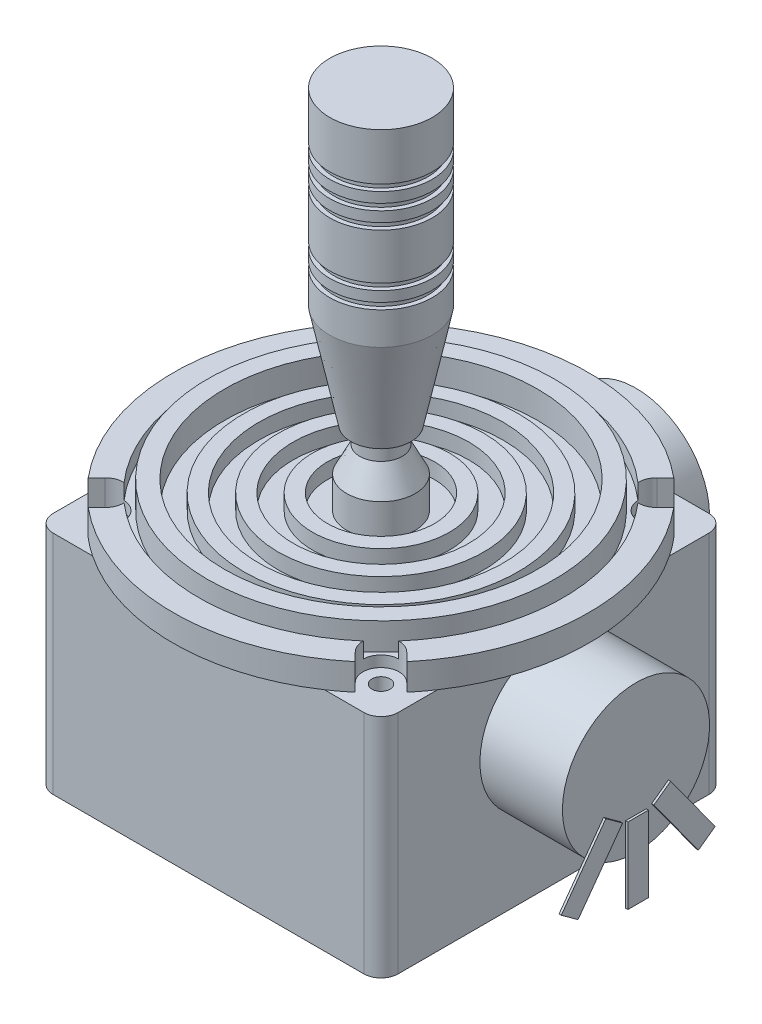
from build123d import *

# Parameters (mm, degrees)
BOSS_EXTRUDE1_DEPTH         = 13.21
SKETCH2_R                   = 8.585
BOSS_EXTRUDE2_DEPTH         = 9.63
SKETCH3_W                   = 2.42
SKETCH3_H                   = 8.85
BOSS_EXTRUDE3_DEPTH         = 0.26
CIRPATTERN2_COUNT           = 10
CIRPATTERN1_COUNT           = 2
CIRPATTERN1_ANGLE           = 90
CIRPATTERN1_COPY_1_SKETCH_W = 2.42
CIRPATTERN1_COPY_1_SKETCH_H = 8.85
CIRPATTERN1_COPY_1_DEPTH    = 0.26
CIRPATTERN1_COPY_2_SKETCH_W = 2.42
CIRPATTERN1_COPY_2_SKETCH_H = 8.85
CIRPATTERN1_COPY_2_DEPTH    = 0.26
CUT_EXTRUDE1_REACH          = 60.953
SKETCH7_R                   = 1.05
CUT_EXTRUDE2_DEPTH          = 4


with BuildPart() as part:
    # Sketch1 → Boss-Extrude1 (new, symmetric)
    with BuildSketch(Plane(origin=(0, 0, 0), x_dir=(1, 0, 0), z_dir=(0, 1, 0))):
        with BuildLine():
            Line((18.125, 20.125), (-18.125, 20.125))
            ThreePointArc((-18.125, 20.125), (-19.539213562, 19.539213562), (-20.125, 18.125))
            Line((-20.125, 18.125), (-20.125, -18.125))
            ThreePointArc((-20.125, -18.125), (-19.539213562, -19.539213562), (-18.125, -20.125))
            Line((-18.125, -20.125), (18.125, -20.125))
            ThreePointArc((18.125, -20.125), (19.539213562, -19.539213562), (20.125, -18.125))
            Line((20.125, -18.125), (20.125, 18.125))
            ThreePointArc((20.125, 18.125), (19.539213562, 19.539213562), (18.125, 20.125))
        make_face()
    extrude(amount=BOSS_EXTRUDE1_DEPTH, both=True)

    # Sketch2 → Boss-Extrude2 (add)
    with BuildSketch(Plane(origin=(20.125, 0, 0), x_dir=(0, 0, -1), z_dir=(1, 0, 0))):
        with Locations(Location((0, 3.395, 0), (0, 0, 180))):
            Circle(SKETCH2_R)
    boss_extrude2 = extrude(amount=BOSS_EXTRUDE2_DEPTH)

    # Sketch3 → Boss-Extrude3 (add)
    with BuildSketch(Plane(origin=(29.755, 0, 0), x_dir=(0, 0, -1), z_dir=(1, 0, 0))):
        with Locations((0, -5.795)):
            Rectangle(SKETCH3_W, SKETCH3_H)
    boss_extrude3 = extrude(amount=BOSS_EXTRUDE3_DEPTH)

    # CirPattern2: Boss-Extrude3 ×10 about axis, 7 skipped
    cirpattern2_axis = Axis((0, 3.395, 0), (1, 0, 0))
    add([boss_extrude3.rotate(cirpattern2_axis, i * 360 / CIRPATTERN2_COUNT) for i in range(1, CIRPATTERN2_COUNT) if i not in (2, 3, 4, 5, 6, 7, 8)])

    # CirPattern1: Boss-Extrude2, Boss-Extrude3 ×2 about axis
    cirpattern1_axis = Axis((0, 0, 0), (0, 1, 0))
    add([boss_extrude2.rotate(cirpattern1_axis, i * CIRPATTERN1_ANGLE / (CIRPATTERN1_COUNT - 1)) for i in range(1, CIRPATTERN1_COUNT)])
    add([boss_extrude3.rotate(cirpattern1_axis, i * CIRPATTERN1_ANGLE / (CIRPATTERN1_COUNT - 1)) for i in range(1, CIRPATTERN1_COUNT)])

    # CirPattern1 copy 1 sketch → CirPattern1 copy 1 (add)
    with BuildSketch(Plane(origin=(-1.995530932, 0.648387304, -29.755), x_dir=(-0.8090169943749475, 0.5877852522924731, 2.9203766201002924e-15), z_dir=(0, 0, -1))):
        with Locations((0, -5.795)):
            Rectangle(CIRPATTERN1_COPY_1_SKETCH_W, CIRPATTERN1_COPY_1_SKETCH_H)
    extrude(amount=CIRPATTERN1_COPY_1_DEPTH)

    # CirPattern1 copy 2 sketch → CirPattern1 copy 2 (add)
    with BuildSketch(Plane(origin=(1.995530932, 0.648387304, -29.755), x_dir=(-0.8090169943749473, -0.5877852522924734, 2.920376620100292e-15), z_dir=(0, 0, -1))):
        with Locations((0, -5.795)):
            Rectangle(CIRPATTERN1_COPY_2_SKETCH_W, CIRPATTERN1_COPY_2_SKETCH_H)
    extrude(amount=CIRPATTERN1_COPY_2_DEPTH)

    # Sketch5 → Revolve1 (revolve)
    with BuildSketch(Plane.XY, mode=Mode.PRIVATE) as revolve1_sk:
        Polygon((0, 13.21), (-24.25, 13.21), (-24.25, 16.3), (-21.25, 16.3), (-21.25, 14.49), (-20.25, 14.49), (-20.25, 17.66), (-18.25, 17.66), (-18.25, 14.49), (-16, 14.49), (-16, 16.3), (-14.25, 16.3), (-14.25, 14.49), (-12, 14.49), (-12, 16.3), (-10.25, 16.3), (-10.25, 14.49), (-8, 14.49), (-8, 16.3), (-6.25, 16.3), (-6.25, 14.49), (-4, 14.49), (-4, 18.21), (-2.485, 21.21), (-2.485, 23.21), (-3.5, 23.21), (-5.985, 35.21), (-5.985, 39), (-5.485, 39), (-5.485, 39.75), (-5.985, 39.75), (-5.985, 40.95), (-5.485, 40.95), (-5.485, 41.7), (-5.985, 41.7), (-5.985, 47.06), (-5.485, 47.06), (-5.485, 47.81), (-5.985, 47.81), (-5.985, 49.01), (-5.485, 49.01), (-5.485, 49.76), (-5.985, 49.76), (-5.985, 50.96), (-5.485, 50.96), (-5.485, 51.71), (-5.985, 51.71), (-5.985, 57.21), (0, 57.21), align=None)
    revolve(revolve1_sk.sketch.rotate(Axis((0, 0, 0), (0, 1, 0)), 270), axis=Axis((0, 0, 0), (0, 1, 0)))

    # Cut-Extrude1: up to this face of the body (flat: up to its plane)
    cut_extrude1_end = Plane(part.part.faces().sort_by_distance((-17.994834976, 13.21, 17.994834976))[0])
    # Sketch6 → Cut-Extrude1 (cut, up to the picked face)
    with BuildSketch(Plane(origin=(0, 16.3, 0), x_dir=(1, 0, 0), z_dir=(0, 1, 0)), mode=Mode.PRIVATE) as cut_extrude1_sk1:
        with BuildLine():
            Line((-17.592816716, 14.587612896), (-18.583978831, 15.57877501))
            ThreePointArc((-18.583978831, 15.57877501), (-17.147339444, 17.147339444), (-15.57877501, 18.583978831))
            Line((-15.57877501, 18.583978831), (-14.587612896, 17.592816716))
            ThreePointArc((-14.587612896, 17.592816716), (-14.587612896, 14.587612896), (-17.592816716, 14.587612896))
        make_face()
    cut_extrude1_tool1 = split(extrude(cut_extrude1_sk1.sketch, amount=-CUT_EXTRUDE1_REACH, mode=Mode.PRIVATE), bisect_by=cut_extrude1_end, keep=Keep.BOTH, mode=Mode.PRIVATE)
    # Sketch6 → Cut-Extrude1 (cut, up to the picked face)
    with BuildSketch(Plane(origin=(0, 16.3, 0), x_dir=(1, 0, 0), z_dir=(0, 1, 0)), mode=Mode.PRIVATE) as cut_extrude1_sk2:
        with BuildLine():
            Line((14.587612896, 17.592816716), (15.57877501, 18.583978831))
            ThreePointArc((15.57877501, 18.583978831), (17.147339444, 17.147339444), (18.583978831, 15.57877501))
            Line((18.583978831, 15.57877501), (17.592816716, 14.587612896))
            ThreePointArc((17.592816716, 14.587612896), (14.587612896, 14.587612896), (14.587612896, 17.592816716))
        make_face()
    cut_extrude1_tool2 = split(extrude(cut_extrude1_sk2.sketch, amount=-CUT_EXTRUDE1_REACH, mode=Mode.PRIVATE), bisect_by=cut_extrude1_end, keep=Keep.BOTH, mode=Mode.PRIVATE)
    # Sketch6 → Cut-Extrude1 (cut, up to the picked face)
    with BuildSketch(Plane(origin=(0, 16.3, 0), x_dir=(1, 0, 0), z_dir=(0, 1, 0)), mode=Mode.PRIVATE) as cut_extrude1_sk3:
        with BuildLine():
            Line((17.592816716, -14.587612896), (18.583978831, -15.57877501))
            ThreePointArc((18.583978831, -15.57877501), (17.147339444, -17.147339444), (15.57877501, -18.583978831))
            Line((15.57877501, -18.583978831), (14.587612896, -17.592816716))
            ThreePointArc((14.587612896, -17.592816716), (14.587612896, -14.587612896), (17.592816716, -14.587612896))
        make_face()
    cut_extrude1_tool3 = split(extrude(cut_extrude1_sk3.sketch, amount=-CUT_EXTRUDE1_REACH, mode=Mode.PRIVATE), bisect_by=cut_extrude1_end, keep=Keep.BOTH, mode=Mode.PRIVATE)
    # Sketch6 → Cut-Extrude1 (cut, up to the picked face)
    with BuildSketch(Plane(origin=(0, 16.3, 0), x_dir=(1, 0, 0), z_dir=(0, 1, 0)), mode=Mode.PRIVATE) as cut_extrude1_sk4:
        with BuildLine():
            Line((-14.587612896, -17.592816716), (-15.57877501, -18.583978831))
            ThreePointArc((-15.57877501, -18.583978831), (-17.147339444, -17.147339444), (-18.583978831, -15.57877501))
            Line((-18.583978831, -15.57877501), (-17.592816716, -14.587612896))
            ThreePointArc((-17.592816716, -14.587612896), (-14.587612896, -14.587612896), (-14.587612896, -17.592816716))
        make_face()
    cut_extrude1_tool4 = split(extrude(cut_extrude1_sk4.sketch, amount=-CUT_EXTRUDE1_REACH, mode=Mode.PRIVATE), bisect_by=cut_extrude1_end, keep=Keep.BOTH, mode=Mode.PRIVATE)
    add(cut_extrude1_tool1.solids().sort_by(Axis((-15.992422, 16.3, -15.992422), (0, -1, 0)))[0], mode=Mode.SUBTRACT)
    add(cut_extrude1_tool2.solids().sort_by(Axis((15.992422, 16.3, -15.992422), (0, -1, 0)))[0], mode=Mode.SUBTRACT)
    add(cut_extrude1_tool3.solids().sort_by(Axis((15.992422, 16.3, 15.992422), (0, -1, 0)))[0], mode=Mode.SUBTRACT)
    add(cut_extrude1_tool4.solids().sort_by(Axis((-15.992422, 16.3, 15.992422), (0, -1, 0)))[0], mode=Mode.SUBTRACT)

    # Sketch7 → Cut-Extrude2 (cut)
    with BuildSketch(Plane(origin=(0, 13.21, 0), x_dir=(1, 0, 0), z_dir=(0, 1, 0))):
        with Locations(Location((-16.25, 16.25, 0), (0, 0, 270))):
            Circle(SKETCH7_R)
        with Locations(Location((16.25, 16.25, 0), (0, 0, 270))):
            Circle(SKETCH7_R)
        with Locations(Location((16.25, -16.25, 0), (0, 0, 90))):
            Circle(SKETCH7_R)
        with Locations(Location((-16.25, -16.25, 0), (0, 0, 90))):
            Circle(SKETCH7_R)
    extrude(amount=-CUT_EXTRUDE2_DEPTH, mode=Mode.SUBTRACT)


solid = part.part
